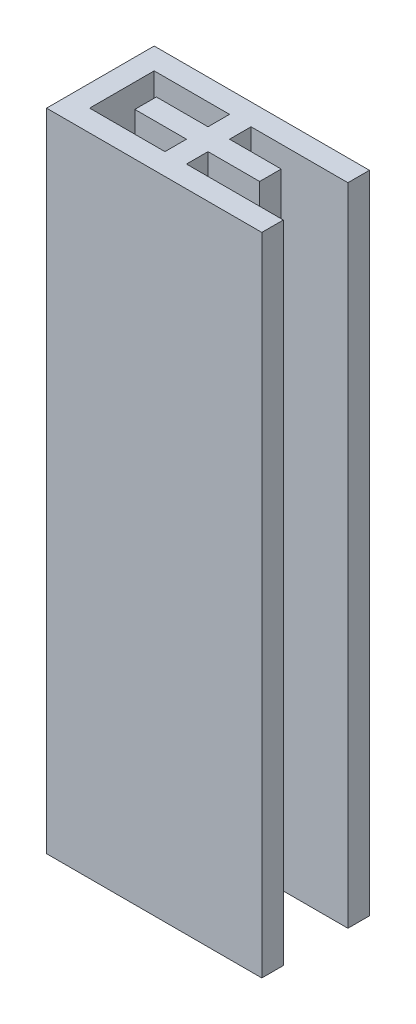
from build123d import *

# Parameters (mm, degrees)
EXTRUDE_1_DEPTH = 300


with BuildPart() as part:
    # Эскиз1 → Бобышка-Вытянуть1 (new body)
    with BuildSketch(Plane(origin=(0, 0, 0), x_dir=(1, 0, 0), z_dir=(0, 1, 0))):
        Polygon((5, -15), (5, -5), (29, -5), (29, 5), (5, 5), (5, 15), (50, 15), (50, 25), (-50, 25), (-50, -25), (50, -25), (50, -15), align=None)
        Polygon((-40, -15), (-40, 15), (-5, 15), (-5, 5), (-29, 5), (-29, -5), (-5, -5), (-5, -15), align=None, mode=Mode.SUBTRACT)
    extrude(amount=EXTRUDE_1_DEPTH)


solid = part.part
